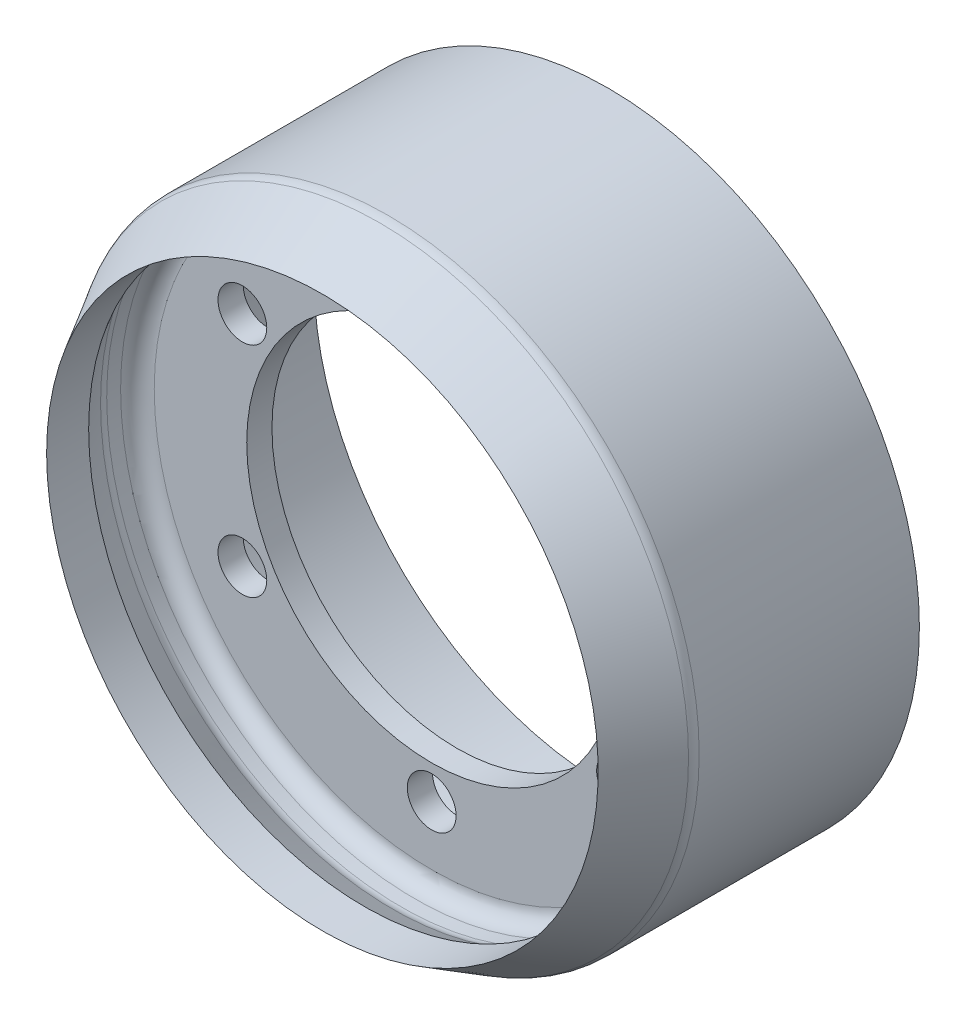
from build123d import *

# Parameters (mm, degrees)
CIRPATTERN1_COUNT = 6


with BuildPart() as part:
    # Sketch1 → Revolve1 (revolve)
    with BuildSketch(Plane(origin=(0, 0, 0), x_dir=(0, 0, -1), z_dir=(1, 0, 0))):
        with BuildLine():
            Line((-8, 16.4), (-4.594744112, 18.366025404))
            ThreePointArc((-4.594744112, 18.366025404), (-4.353563157, 18.465925826), (-4.094744112, 18.5))
            Line((-4.094744112, 18.5), (9, 18.5))
            Line((9, 18.5), (9, 17.5))
            Line((9, 17.5), (0, 17.5))
            Line((0, 17.5), (0, 11))
            Line((0, 11), (-1.5, 11))
            Line((-1.5, 11), (-1.5, 16.5))
            ThreePointArc((-1.5, 16.5), (-1.792893219, 17.207106781), (-2.5, 17.5))
            Line((-2.5, 17.5), (-3.326794919, 17.5))
            ThreePointArc((-3.326794919, 17.5), (-3.585613964, 17.465925826), (-3.826794919, 17.366025404))
            Line((-3.826794919, 17.366025404), (-5.5, 16.4))
            Line((-5.5, 16.4), (-8, 16.4))
        make_face()
    revolve(axis=Axis((0, 0, 0), (0, 0, 1)))

    # Sketch2 → M2.5 Clearance Hole1 (revolve, cut)
    with BuildSketch(Plane(origin=(0, 13, 1.5), x_dir=(0, -1, 0), z_dir=(1, 0, 0))):
        Polygon((0, 0), (0, 23.871247898), (1.45, 23), (1.45, 0), align=None)
    m2_5_clearance_hole1 = revolve(axis=Axis((0, 13, 7.85), (0, 0, -1)), mode=Mode.SUBTRACT)

    # CirPattern1: M2.5 Clearance Hole1 ×6 about axis
    cirpattern1_axis = Axis((0, 0, 4.094744112), (0, 0, -1))
    for i in range(1, CIRPATTERN1_COUNT):
        add(m2_5_clearance_hole1.rotate(cirpattern1_axis, i * 360 / CIRPATTERN1_COUNT), mode=Mode.SUBTRACT)


solid = part.part
